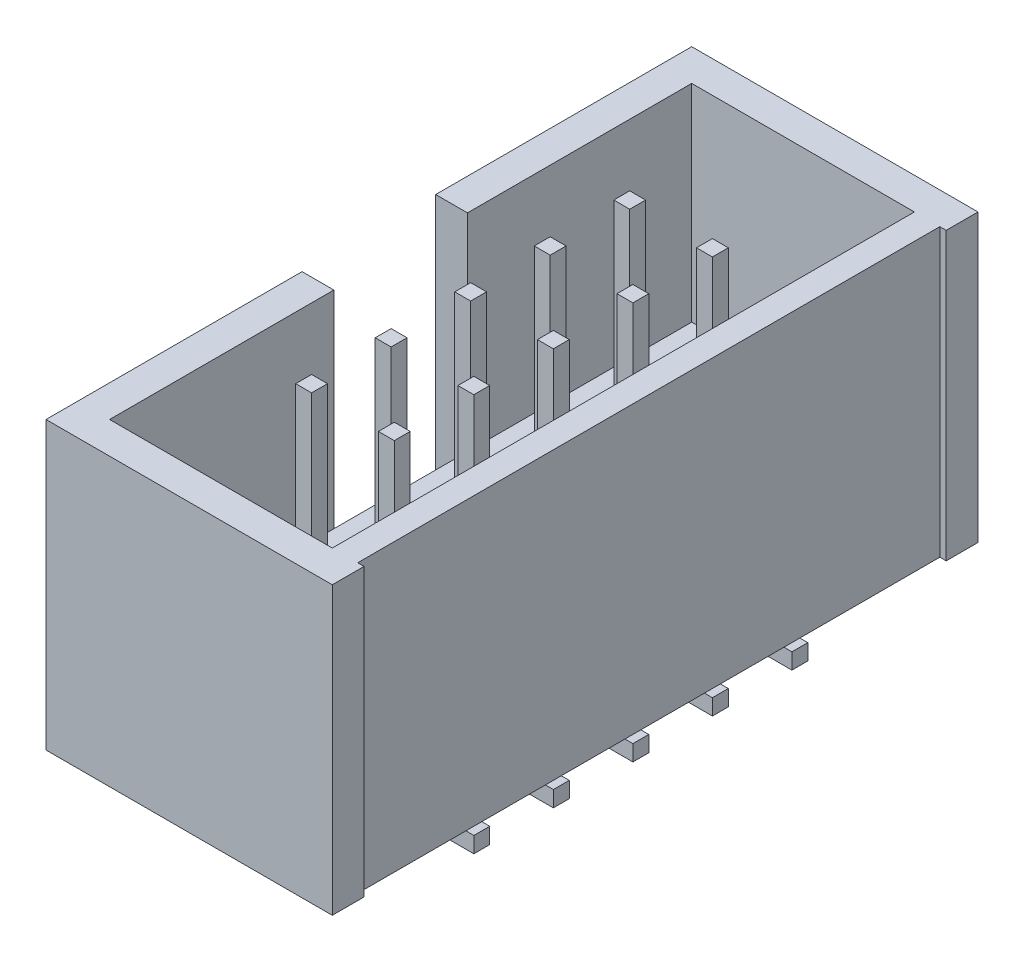
from build123d import *

# Parameters (mm, degrees)
CROQUIS1_W              = 9
CROQUIS1_H              = 20.3
SALIENTE_EXTRUIR1_DEPTH = 9
CROQUIS2_W              = 7
CROQUIS2_H              = 18.3
CORTAR_EXTRUIR1_DEPTH   = 6.5
CROQUIS3_W              = 18.3
CROQUIS3_H              = 9
CORTAR_EXTRUIR2_DEPTH   = 0.2
CROQUIS4_W              = 4.2
CROQUIS4_H              = 7.7
CORTAR_EXTRUIR3_DEPTH   = 1
CROQUIS5_W              = 0.5
CROQUIS5_H              = 0.5
SALIENTE_EXTRUIR2_DEPTH = 10
CROQUIS6_W              = 0.5
CROQUIS6_H              = 0.5
SALIENTE_EXTRUIR3_DEPTH = 2.5


with BuildPart() as part:
    # Croquis1 → Saliente-Extruir1 (new body)
    with BuildSketch(Plane(origin=(0, 0, 0), x_dir=(1, 0, 0), z_dir=(0, 1, 0))):
        with Locations((4.5, 10.15)):
            Rectangle(CROQUIS1_W, CROQUIS1_H)
    extrude(amount=SALIENTE_EXTRUIR1_DEPTH)

    # Croquis2 → Cortar-Extruir1 (cut)
    with BuildSketch(Plane(origin=(0, 9, 0), x_dir=(1, 0, 0), z_dir=(0, 1, 0))):
        with Locations((4.5, 10.15)):
            Rectangle(CROQUIS2_W, CROQUIS2_H)
    extrude(amount=-CORTAR_EXTRUIR1_DEPTH, mode=Mode.SUBTRACT)

    # Croquis3 → Cortar-Extruir2 (cut)
    with BuildSketch(Plane(origin=(9, 0, 0), x_dir=(0, 0, -1), z_dir=(1, 0, 0))):
        with Locations((10.15, 4.5)):
            Rectangle(CROQUIS3_W, CROQUIS3_H)
    extrude(amount=-CORTAR_EXTRUIR2_DEPTH, mode=Mode.SUBTRACT)

    # Croquis4 → Cortar-Extruir3 (cut)
    with BuildSketch(Plane.ZY):
        with Locations((-10.15, 5.15)):
            Rectangle(CROQUIS4_W, CROQUIS4_H)
    extrude(amount=-CORTAR_EXTRUIR3_DEPTH, mode=Mode.SUBTRACT)

    # Croquis5 → Saliente-Extruir2 (add)
    with BuildSketch(Plane(origin=(0, 9, 0), x_dir=(1, 0, 0), z_dir=(0, 1, 0))):
        with Locations((5.8, 15.15)):
            Rectangle(CROQUIS5_W, CROQUIS5_H)
        with Locations((3.2, 15.15)):
            Rectangle(CROQUIS5_W, CROQUIS5_H)
        with Locations((5.8, 12.65)):
            Rectangle(CROQUIS5_W, CROQUIS5_H)
        with Locations((5.8, 10.15)):
            Rectangle(CROQUIS5_W, CROQUIS5_H)
        with Locations((5.8, 7.65)):
            Rectangle(CROQUIS5_W, CROQUIS5_H)
        with Locations((5.8, 5.15)):
            Rectangle(CROQUIS5_W, CROQUIS5_H)
        with Locations((3.2, 12.65)):
            Rectangle(CROQUIS5_W, CROQUIS5_H)
        with Locations((3.2, 10.15)):
            Rectangle(CROQUIS5_W, CROQUIS5_H)
        with Locations((3.2, 7.65)):
            Rectangle(CROQUIS5_W, CROQUIS5_H)
        with Locations((3.2, 5.15)):
            Rectangle(CROQUIS5_W, CROQUIS5_H)
    extrude(amount=-SALIENTE_EXTRUIR2_DEPTH)

    # Croquis6 → Saliente-Extruir3 (add)
    with BuildSketch(Plane.ZY.offset(-2.95)):
        with Locations((-5.15, -0.75)):
            Rectangle(CROQUIS6_W, CROQUIS6_H)
        with Locations((-7.65, -0.75)):
            Rectangle(CROQUIS6_W, CROQUIS6_H)
        with Locations((-10.15, -0.75)):
            Rectangle(CROQUIS6_W, CROQUIS6_H)
        with Locations((-12.65, -0.75)):
            Rectangle(CROQUIS6_W, CROQUIS6_H)
        with Locations((-15.15, -0.75)):
            Rectangle(CROQUIS6_W, CROQUIS6_H)
    saliente_extruir3 = extrude(amount=SALIENTE_EXTRUIR3_DEPTH)

    # Simetría1: Saliente-Extruir3 across plane
    add(saliente_extruir3.mirror(Plane(origin=(4.5, 0, 0), x_dir=(0, 0, 1), z_dir=(1, 0, 0))))


solid = part.part
